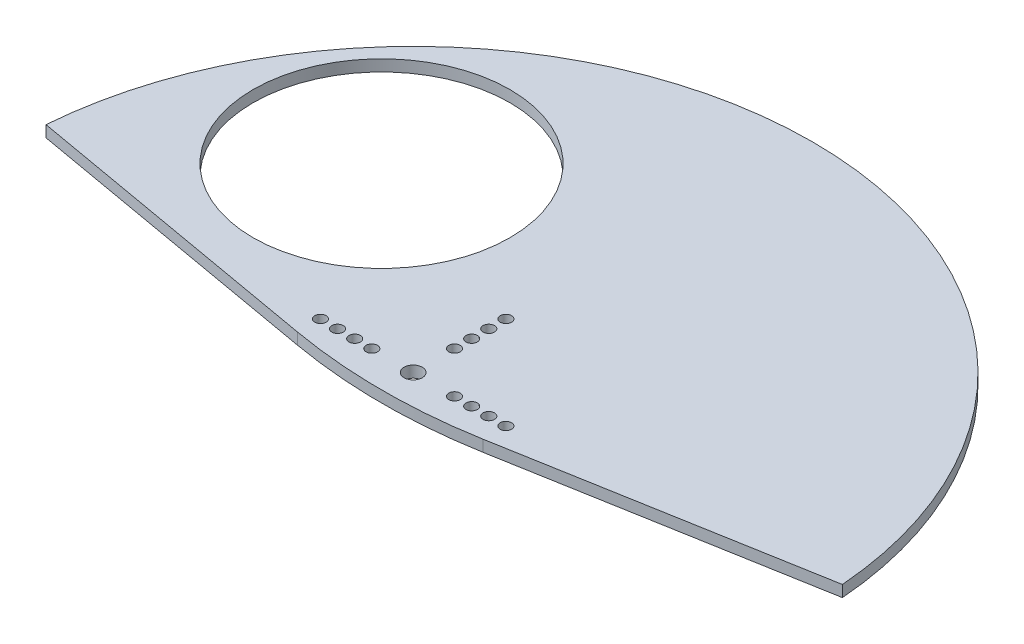
from build123d import *

# Parameters (mm, degrees)
SKETCH_1_R      = 1
SKETCH_1_R_2    = 1.6
SKETCH_1_R_3    = 22.5
EXTRUDE_1_DEPTH = 1


with BuildPart() as part:
    # 草圖1 → 填料-伸長1 (new, symmetric)
    with BuildSketch(Plane(origin=(0, 0, 0), x_dir=(1, 0, 0), z_dir=(0, 1, 0))):
        with BuildLine():
            Line((-69.788277988, 5.440244057), (-16.249993495, -4))
            ThreePointArc((-16.249993495, -4), (0, -5.421690213), (16.249993495, -4))
            Line((16.249993495, -4), (69.788277988, 5.440244057))
            ThreePointArc((69.788277988, 5.440244057), (0, 70), (-69.788277988, 5.440244057))
        make_face()
        with Locations(Location((16.249993495, 0, 0), (0, 0, 270))):
            Circle(SKETCH_1_R, mode=Mode.SUBTRACT)
        with Locations(Location((13.249989391, 0, 0), (0, 0, 270))):
            Circle(SKETCH_1_R, mode=Mode.SUBTRACT)
        with Locations(Location((10.249991793, 0, 0), (0, 0, 270))):
            Circle(SKETCH_1_R, mode=Mode.SUBTRACT)
        with Locations(Location((7.249994195, 0, 0), (0, 0, 270))):
            Circle(SKETCH_1_R, mode=Mode.SUBTRACT)
        with Locations(Location((-16.249993495, 0, 0), (0, 0, 270))):
            Circle(SKETCH_1_R, mode=Mode.SUBTRACT)
        with Locations(Location((-13.249989391, 0, 0), (0, 0, 270))):
            Circle(SKETCH_1_R, mode=Mode.SUBTRACT)
        with Locations(Location((-10.249991793, 0, 0), (0, 0, 270))):
            Circle(SKETCH_1_R, mode=Mode.SUBTRACT)
        with Locations(Location((-7.249994195, 0, 0), (0, 0, 270))):
            Circle(SKETCH_1_R, mode=Mode.SUBTRACT)
        with Locations(Location((0, 16.249993495, 0), (0, 0, 270))):
            Circle(SKETCH_1_R, mode=Mode.SUBTRACT)
        with Locations(Location((0, 13.249989391, 0), (0, 0, 270))):
            Circle(SKETCH_1_R, mode=Mode.SUBTRACT)
        with Locations(Location((0, 10.249991793, 0), (0, 0, 270))):
            Circle(SKETCH_1_R, mode=Mode.SUBTRACT)
        with Locations(Location((0, 7.249994195, 0), (0, 0, 270))):
            Circle(SKETCH_1_R, mode=Mode.SUBTRACT)
        with Locations(Location((0, 0, 0), (0, 0, 270))):
            Circle(SKETCH_1_R_2, mode=Mode.SUBTRACT)
        with Locations(Location((-34.47199994, 28.925442436, 0), (0, 0, 270))):
            Circle(SKETCH_1_R_3, mode=Mode.SUBTRACT)
    extrude(amount=EXTRUDE_1_DEPTH, both=True)


solid = part.part
